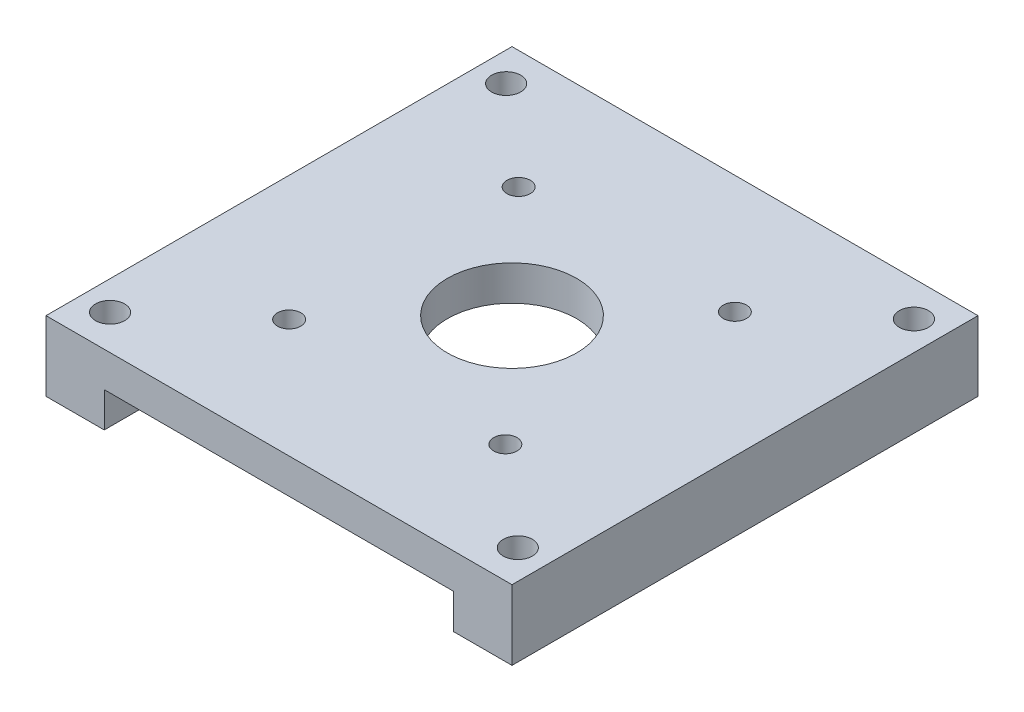
from build123d import *

# Parameters (mm, degrees)
SKETCH1_W           = 101.6
SKETCH1_H           = 101.6
SKETCH1_R           = 2.54
SKETCH1_R_2         = 14.097
BOSS_EXTRUDE1_DEPTH = 7.62
SKETCH1_3_W         = 12.7
SKETCH1_3_H         = 101.6
BOSS_EXTRUDE2_DEPTH = 7.62
SKETCH3_R           = 3.175
CUT_EXTRUDE1_DEPTH  = 25.4


with BuildPart() as part:
    # Sketch1 → Boss-Extrude1 (new body)
    with BuildSketch(Plane(origin=(0, 0, 0), x_dir=(1, 0, 0), z_dir=(0, 1, 0))):
        with Locations((50.8, 50.8)):
            Rectangle(SKETCH1_W, SKETCH1_H)
        with BuildLine():
            ThreePointArc((27.2288, 23.241), (25.794350063, 23.684824106), (24.86119419, 24.86119419))
            ThreePointArc((24.86119419, 24.86119419), (25.432748776, 27.577051224), (28.14860581, 28.14860581))
            ThreePointArc((28.14860581, 28.14860581), (29.725329467, 25.313089088), (27.2288, 23.241))
        make_face(mode=Mode.SUBTRACT)
        with Locations((74.3712, 25.781)):
            Circle(SKETCH1_R, mode=Mode.SUBTRACT)
        with Locations((50.8, 50.8)):
            Circle(SKETCH1_R_2, mode=Mode.SUBTRACT)
        with Locations((27.2288, 75.819)):
            Circle(SKETCH1_R, mode=Mode.SUBTRACT)
        with Locations((74.3712, 75.819)):
            Circle(SKETCH1_R, mode=Mode.SUBTRACT)
    extrude(amount=BOSS_EXTRUDE1_DEPTH)

    # Sketch1<3> → Boss-Extrude2 (add)
    with BuildSketch(Plane(origin=(0, 0, 0), x_dir=(1, 0, 0), z_dir=(0, 1, 0))):
        with Locations((6.35, 50.8)):
            Rectangle(SKETCH1_3_W, SKETCH1_3_H)
        with Locations((95.25, 50.8)):
            Rectangle(SKETCH1_3_W, SKETCH1_3_H)
    extrude(amount=-BOSS_EXTRUDE2_DEPTH)

    # Sketch3 → Cut-Extrude1 (cut)
    with BuildSketch(Plane.XZ.offset(7.62)):
        with Locations((6.35, -7.62)):
            Circle(SKETCH3_R)
        with Locations((95.25, -7.62)):
            Circle(SKETCH3_R)
        with Locations((6.35, -93.98)):
            Circle(SKETCH3_R)
        with Locations((95.25, -93.98)):
            Circle(SKETCH3_R)
    extrude(amount=-CUT_EXTRUDE1_DEPTH, mode=Mode.SUBTRACT)


solid = part.part
